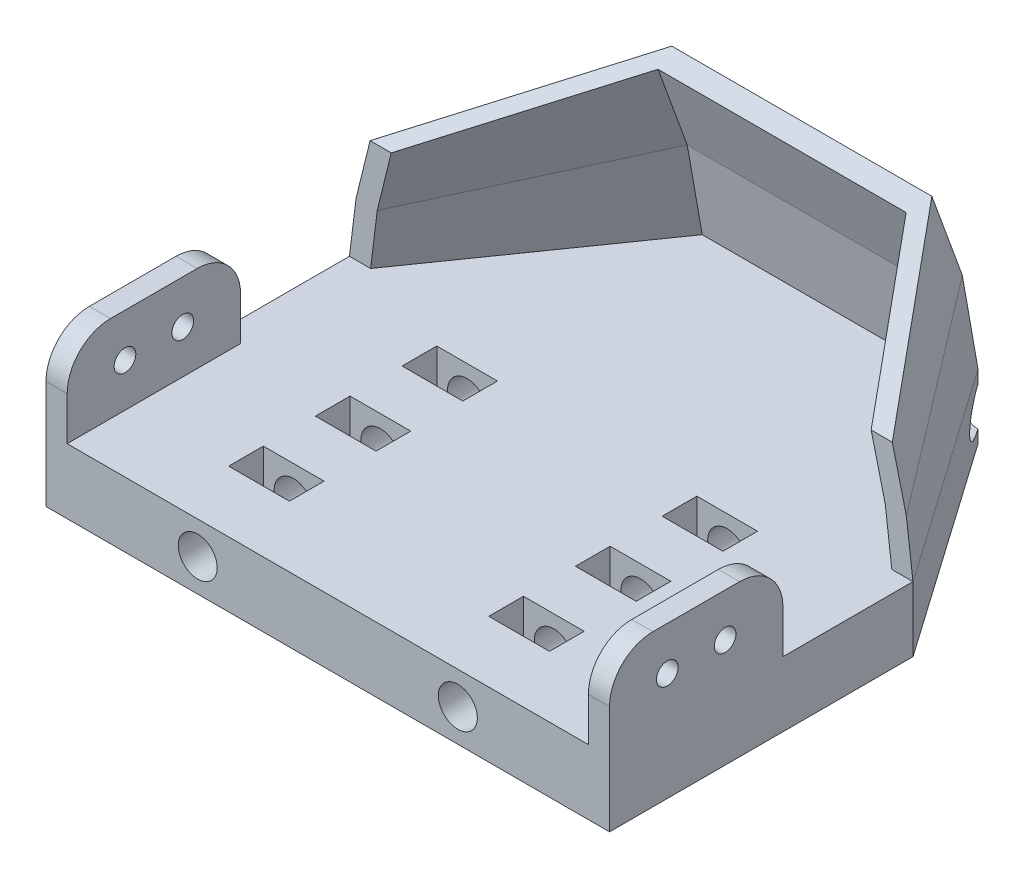
from build123d import *

# Parameters (mm, degrees)
EXTRUDE_1_DEPTH        = 15
SKETCH_4_W             = 130
SKETCH_4_H             = 53.153449772
CUT_EXTRUDE_1_DEPTH    = 70
SKETCH_5_W             = 4.882622246
SKETCH_5_H             = 40
EXTRUDE_2_DEPTH        = 20
SKETCH_6_R             = 2.5
CUT_EXTRUDE_2_DEPTH    = 186.212230178
FILLET_1_R             = 10
SKETCH_7_R             = 4.5
CUT_EXTRUDE_3_DEPTH    = 148.066550223
SKETCH_8_W             = 14
SKETCH_8_H             = 8
CUT_EXTRUDE_4_DEPTH    = 143.159857501
PATTERN_LINEAR_1_COUNT = 3
PATTERN_LINEAR_1_PITCH = 20


with BuildPart() as part:
    # 草图1 → 凸台-拉伸1 (new body)
    with BuildSketch(Plane(origin=(0, 0, 0), x_dir=(1, 0, 0), z_dir=(0, 1, 0))):
        Polygon((-65, 0), (65, 0), (65, 70), (30, 120), (-30, 120), (-65, 70), align=None)
    extrude(amount=EXTRUDE_1_DEPTH)

    # 草图2 → 放样1 section 0
    with BuildSketch(Plane(origin=(0, 15, 0), x_dir=(1, 0, 0), z_dir=(0, 1, 0))):
        with BuildLine():
            Line((-65, 70), (-61.723072318, 67.706150623))
            Line((-61.723072318, 67.706150623), (-28.617377754, 115))
            Line((-28.617377754, 115), (28.617377754, 115))
            Line((28.617377754, 115), (61.723072318, 67.706150623))
            Line((61.723072318, 67.706150623), (65, 70))
            Line((65, 70), (30, 120))
            Line((30, 120), (-30, 120))
            Line((-30, 120), (-65, 70))
        make_face()
    # 草图3 → 放样1 section 1
    with BuildSketch(Plane(origin=(0, 14.547694656, 2.565151075), x_dir=(1, 0, 0), z_dir=(0, 0.984807753012208, 0.17364817766693072))):
        with BuildLine():
            Line((-65, 71.541265376), (-61.723072318, 69.282264725))
            Line((-61.723072318, 69.282264725), (-28.617377754, 115.857614261))
            Line((-28.617377754, 115.857614261), (28.617377754, 115.857614261))
            Line((28.617377754, 115.857614261), (61.723072318, 69.282264725))
            Line((61.723072318, 69.282264725), (65, 71.541265376))
            Line((65, 71.541265376), (30, 120.781653026))
            Line((30, 120.781653026), (-30, 120.781653026))
            Line((-30, 120.781653026), (-65, 71.541265376))
        make_face()
    loft()

    # 草图9 → 放样2 section 0
    with BuildSketch(Plane(origin=(0, 14.547694656, 2.565151075), x_dir=(1, 0, 0), z_dir=(0, 0.9848077530122079, 0.17364817766693139))):
        with BuildLine():
            Line((-65, 71.541265376), (-61.723072318, 69.282264725))
            Line((-61.723072318, 69.282264725), (-28.617377754, 115.857614261))
            Line((-28.617377754, 115.857614261), (28.617377754, 115.857614261))
            Line((28.617377754, 115.857614261), (61.723072318, 69.282264725))
            Line((61.723072318, 69.282264725), (65, 71.541265376))
            Line((65, 71.541265376), (30, 120.781653026))
            Line((30, 120.781653026), (-30, 120.781653026))
            Line((-30, 120.781653026), (-65, 71.541265376))
        make_face()
    # 草图10 → 放样2 section 1
    with BuildSketch(Plane(origin=(0, 13.245333323, 4.820907073), x_dir=(1, 0, 0), z_dir=(0, 0.9396926207859081, 0.34202014332566943))):
        with BuildLine():
            Line((-65, 73.019543877), (-61.723072318, 70.794862522))
            Line((-61.723072318, 70.794862522), (-28.617377754, 116.662627845))
            Line((-28.617377754, 116.662627845), (28.617377754, 116.662627845))
            Line((28.617377754, 116.662627845), (61.723072318, 70.794862522))
            Line((61.723072318, 70.794862522), (65, 73.019543877))
            Line((65, 73.019543877), (30, 121.511859397))
            Line((30, 121.511859397), (-30, 121.511859397))
            Line((-30, 121.511859397), (-65, 73.019543877))
        make_face()
    loft()

    # 草图4 → 切除-拉伸1 (cut)
    with BuildSketch(Plane.XY):
        with Locations((0, 41.576724886)):
            Rectangle(SKETCH_4_W, SKETCH_4_H)
    extrude(amount=-CUT_EXTRUDE_1_DEPTH, mode=Mode.SUBTRACT)

    # 草图5 → 凸台-拉伸2 (add)
    with BuildSketch(Plane(origin=(0, 15, 0), x_dir=(1, 0, 0), z_dir=(0, 1, 0))):
        with Locations((62.558688877, 20)):
            Rectangle(SKETCH_5_W, SKETCH_5_H)
        with Locations((-62.558688877, 20)):
            Rectangle(SKETCH_5_W, SKETCH_5_H)
    extrude(amount=EXTRUDE_2_DEPTH)

    # 草图6 → 切除-拉伸2 (cut, through all)
    with BuildSketch(Plane.ZY.offset(65)):
        with Locations((-26.666666667, 25)):
            Circle(SKETCH_6_R)
        with Locations((-13.333333333, 25)):
            Circle(SKETCH_6_R)
    extrude(amount=-CUT_EXTRUDE_2_DEPTH, mode=Mode.SUBTRACT)

    # 圆角1
    fillet_1_edges = [part.edges().sort_by_distance(p)[0] for p in [
        (62.558688877, 35, 0),
        (62.558688877, 35, -40),
        (-62.558688877, 35, 0),
        (-62.558688877, 35, -40),
    ]]
    fillet(fillet_1_edges, radius=FILLET_1_R)

    # 草图7 → 切除-拉伸3 (cut, through all)
    with BuildSketch(Plane.XY):
        with Locations((-30, 7.5)):
            Circle(SKETCH_7_R)
        with Locations((30, 7.5)):
            Circle(SKETCH_7_R)
    extrude(amount=-CUT_EXTRUDE_3_DEPTH, mode=Mode.SUBTRACT)

    # 草图8 → 切除-拉伸4 (cut, through all)
    with BuildSketch(Plane(origin=(0, 15, 0), x_dir=(1, 0, 0), z_dir=(0, 1, 0))):
        with Locations((-30, 58.142993984)):
            Rectangle(SKETCH_8_W, SKETCH_8_H)
        with Locations((30, 58.142993984)):
            Rectangle(SKETCH_8_W, SKETCH_8_H)
    cut_extrude_4 = extrude(amount=-CUT_EXTRUDE_4_DEPTH, mode=Mode.SUBTRACT)

    # 阵列(线性)1: 切除-拉伸4 ×3
    with Locations(*[(0, 0, i * PATTERN_LINEAR_1_PITCH) for i in range(1, PATTERN_LINEAR_1_COUNT)]):
        add(cut_extrude_4, mode=Mode.SUBTRACT)


solid = part.part
